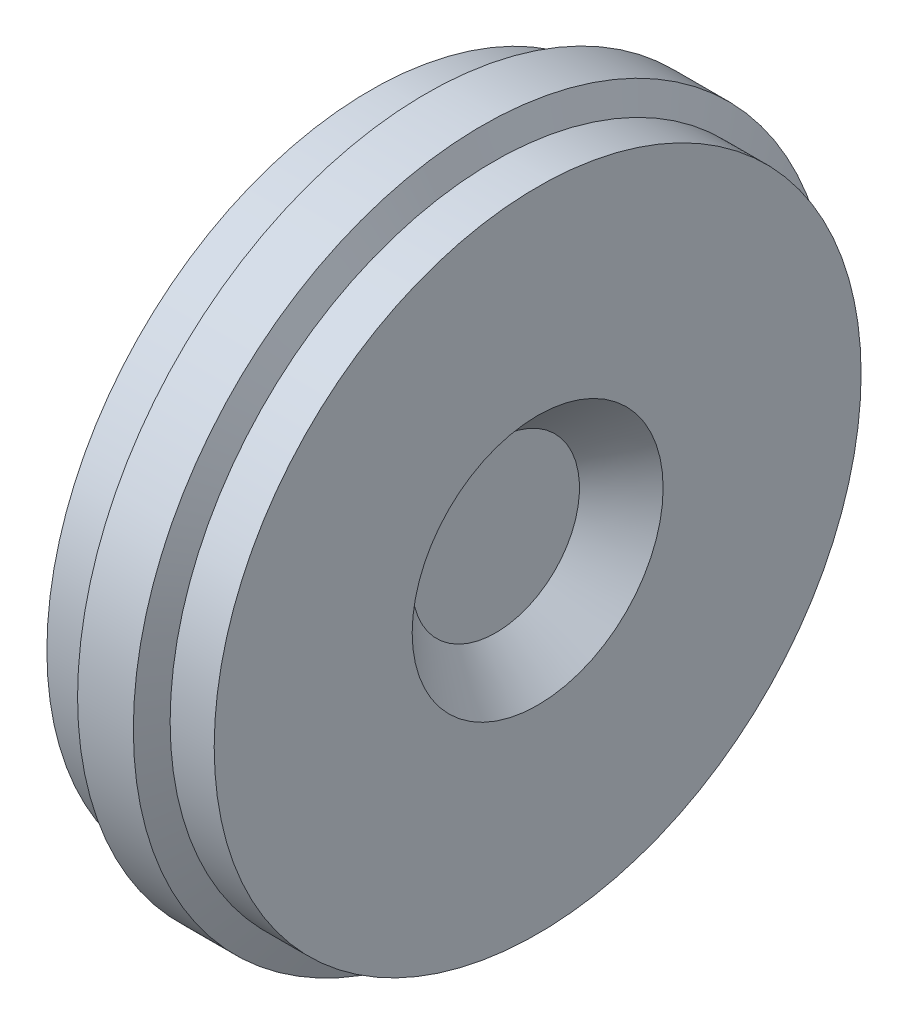
from build123d import *


with BuildPart() as part:
    # Sketch1 → Revolve1 (revolve)
    with BuildSketch(Plane.XY, mode=Mode.PRIVATE) as revolve1_sk:
        Polygon((0, 0), (0, 125), (-10, 125), (-14.196768923, 116), (-30, 116), (-30, 45), (-15, 30), (-15, 0), align=None)
    revolve(revolve1_sk.sketch.rotate(Axis((0, 0, 0), (1, 0, 0)), 90), axis=Axis((0, 0, 0), (1, 0, 0)))

    # Mirror1: part across plane


with BuildPart() as part_1:
    add(part.part)
    add(part.part.mirror(Plane.ZY))


solid = part_1.part
